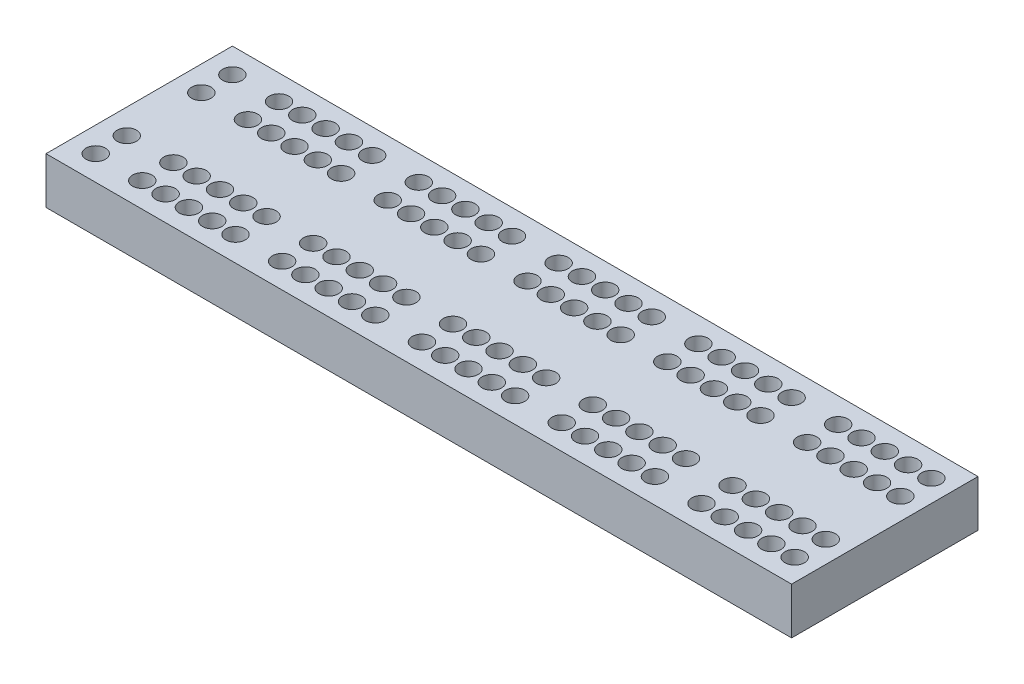
from build123d import *

# Parameters (mm, degrees)
SKETCH1_W            = 304.8
SKETCH1_H            = 19.05
BOSS_EXTRUDE1_DEPTH  = 38.1
LPATTERN1_COUNT      = 31
LPATTERN1_PITCH      = 9.525
LPATTERN1_COUNT_DIR2 = 2
LPATTERN1_PITCH_DIR2 = 12.7


with BuildPart() as part:
    # Sketch1 → Boss-Extrude1 (new, symmetric)
    with BuildSketch(Plane.XY):
        with Locations((152.4, -9.525)):
            Rectangle(SKETCH1_W, SKETCH1_H)
    extrude(amount=BOSS_EXTRUDE1_DEPTH, both=True)

    # Sketch4 → 5/16 (0.3125) Diameter Hole1 (revolve, cut)
    with BuildSketch(Plane(origin=(10.16, 0, -27.94), x_dir=(0, 0, 1), z_dir=(1, 0, 0))):
        Polygon((0, 0), (0, 15.084665582), (3.96875, 12.7), (3.96875, 0), align=None)
    f_5_16_0_3125_diameter_hole1 = revolve(axis=Axis((10.16, 6.35, -27.94), (0, -1, 0)), mode=Mode.SUBTRACT)

    # LPattern1: 5_16 _0.3125_ Diameter Hole1 31 × 2, 10 skipped
    with Locations(*[(i * LPATTERN1_PITCH, 0, j * LPATTERN1_PITCH_DIR2) for i in range(LPATTERN1_COUNT) for j in range(LPATTERN1_COUNT_DIR2) if (i, j) not in ((0, 0), (1, 0), (1, 1), (7, 0), (7, 1), (13, 0), (13, 1), (19, 0), (19, 1), (25, 0), (25, 1))]):
        add(f_5_16_0_3125_diameter_hole1, mode=Mode.SUBTRACT)

    # Mirror1: 5/16 (0.3125) Diameter Hole1 across plane
    add(f_5_16_0_3125_diameter_hole1.mirror(Plane.XY), mode=Mode.SUBTRACT)

    # Mirror1 copy 1 sketch → Mirror1 copy 1 (revolve, cut)
    with BuildSketch(Plane(origin=(10.16, 0, 15.24), x_dir=(0, 0, -1), z_dir=(1, 0, 0))):
        Polygon((0, 0), (0, -15.084665582), (3.96875, -12.7), (3.96875, 0), align=None)
    revolve(axis=Axis((10.16, 6.35, 15.24), (0, 1, 0)), mode=Mode.SUBTRACT)

    # Mirror1 copy 2 sketch → Mirror1 copy 2 (revolve, cut)
    with BuildSketch(Plane(origin=(29.21, 0, 27.94), x_dir=(0, 0, -1), z_dir=(1, 0, 0))):
        Polygon((0, 0), (0, -15.084665582), (3.96875, -12.7), (3.96875, 0), align=None)
    revolve(axis=Axis((29.21, 6.35, 27.94), (0, 1, 0)), mode=Mode.SUBTRACT)

    # Mirror1 copy 3 sketch → Mirror1 copy 3 (revolve, cut)
    with BuildSketch(Plane(origin=(29.21, 0, 15.24), x_dir=(0, 0, -1), z_dir=(1, 0, 0))):
        Polygon((0, 0), (0, -15.084665582), (3.96875, -12.7), (3.96875, 0), align=None)
    revolve(axis=Axis((29.21, 6.35, 15.24), (0, 1, 0)), mode=Mode.SUBTRACT)

    # Mirror1 copy 4 sketch → Mirror1 copy 4 (revolve, cut)
    with BuildSketch(Plane(origin=(38.735, 0, 27.94), x_dir=(0, 0, -1), z_dir=(1, 0, 0))):
        Polygon((0, 0), (0, -15.084665582), (3.96875, -12.7), (3.96875, 0), align=None)
    revolve(axis=Axis((38.735, 6.35, 27.94), (0, 1, 0)), mode=Mode.SUBTRACT)

    # Mirror1 copy 5 sketch → Mirror1 copy 5 (revolve, cut)
    with BuildSketch(Plane(origin=(38.735, 0, 15.24), x_dir=(0, 0, -1), z_dir=(1, 0, 0))):
        Polygon((0, 0), (0, -15.084665582), (3.96875, -12.7), (3.96875, 0), align=None)
    revolve(axis=Axis((38.735, 6.35, 15.24), (0, 1, 0)), mode=Mode.SUBTRACT)

    # Mirror1 copy 6 sketch → Mirror1 copy 6 (revolve, cut)
    with BuildSketch(Plane(origin=(48.26, 0, 27.94), x_dir=(0, 0, -1), z_dir=(1, 0, 0))):
        Polygon((0, 0), (0, -15.084665582), (3.96875, -12.7), (3.96875, 0), align=None)
    revolve(axis=Axis((48.26, 6.35, 27.94), (0, 1, 0)), mode=Mode.SUBTRACT)

    # Mirror1 copy 7 sketch → Mirror1 copy 7 (revolve, cut)
    with BuildSketch(Plane(origin=(48.26, 0, 15.24), x_dir=(0, 0, -1), z_dir=(1, 0, 0))):
        Polygon((0, 0), (0, -15.084665582), (3.96875, -12.7), (3.96875, 0), align=None)
    revolve(axis=Axis((48.26, 6.35, 15.24), (0, 1, 0)), mode=Mode.SUBTRACT)

    # Mirror1 copy 8 sketch → Mirror1 copy 8 (revolve, cut)
    with BuildSketch(Plane(origin=(57.785, 0, 27.94), x_dir=(0, 0, -1), z_dir=(1, 0, 0))):
        Polygon((0, 0), (0, -15.084665582), (3.96875, -12.7), (3.96875, 0), align=None)
    revolve(axis=Axis((57.785, 6.35, 27.94), (0, 1, 0)), mode=Mode.SUBTRACT)

    # Mirror1 copy 9 sketch → Mirror1 copy 9 (revolve, cut)
    with BuildSketch(Plane(origin=(57.785, 0, 15.24), x_dir=(0, 0, -1), z_dir=(1, 0, 0))):
        Polygon((0, 0), (0, -15.084665582), (3.96875, -12.7), (3.96875, 0), align=None)
    revolve(axis=Axis((57.785, 6.35, 15.24), (0, 1, 0)), mode=Mode.SUBTRACT)

    # Mirror1 copy 10 sketch → Mirror1 copy 10 (revolve, cut)
    with BuildSketch(Plane(origin=(67.31, 0, 27.94), x_dir=(0, 0, -1), z_dir=(1, 0, 0))):
        Polygon((0, 0), (0, -15.084665582), (3.96875, -12.7), (3.96875, 0), align=None)
    revolve(axis=Axis((67.31, 6.35, 27.94), (0, 1, 0)), mode=Mode.SUBTRACT)

    # Mirror1 copy 11 sketch → Mirror1 copy 11 (revolve, cut)
    with BuildSketch(Plane(origin=(67.31, 0, 15.24), x_dir=(0, 0, -1), z_dir=(1, 0, 0))):
        Polygon((0, 0), (0, -15.084665582), (3.96875, -12.7), (3.96875, 0), align=None)
    revolve(axis=Axis((67.31, 6.35, 15.24), (0, 1, 0)), mode=Mode.SUBTRACT)

    # Mirror1 copy 12 sketch → Mirror1 copy 12 (revolve, cut)
    with BuildSketch(Plane(origin=(86.36, 0, 27.94), x_dir=(0, 0, -1), z_dir=(1, 0, 0))):
        Polygon((0, 0), (0, -15.084665582), (3.96875, -12.7), (3.96875, 0), align=None)
    revolve(axis=Axis((86.36, 6.35, 27.94), (0, 1, 0)), mode=Mode.SUBTRACT)

    # Mirror1 copy 13 sketch → Mirror1 copy 13 (revolve, cut)
    with BuildSketch(Plane(origin=(86.36, 0, 15.24), x_dir=(0, 0, -1), z_dir=(1, 0, 0))):
        Polygon((0, 0), (0, -15.084665582), (3.96875, -12.7), (3.96875, 0), align=None)
    revolve(axis=Axis((86.36, 6.35, 15.24), (0, 1, 0)), mode=Mode.SUBTRACT)

    # Mirror1 copy 14 sketch → Mirror1 copy 14 (revolve, cut)
    with BuildSketch(Plane(origin=(95.885, 0, 27.94), x_dir=(0, 0, -1), z_dir=(1, 0, 0))):
        Polygon((0, 0), (0, -15.084665582), (3.96875, -12.7), (3.96875, 0), align=None)
    revolve(axis=Axis((95.885, 6.35, 27.94), (0, 1, 0)), mode=Mode.SUBTRACT)

    # Mirror1 copy 15 sketch → Mirror1 copy 15 (revolve, cut)
    with BuildSketch(Plane(origin=(95.885, 0, 15.24), x_dir=(0, 0, -1), z_dir=(1, 0, 0))):
        Polygon((0, 0), (0, -15.084665582), (3.96875, -12.7), (3.96875, 0), align=None)
    revolve(axis=Axis((95.885, 6.35, 15.24), (0, 1, 0)), mode=Mode.SUBTRACT)

    # Mirror1 copy 16 sketch → Mirror1 copy 16 (revolve, cut)
    with BuildSketch(Plane(origin=(105.41, 0, 27.94), x_dir=(0, 0, -1), z_dir=(1, 0, 0))):
        Polygon((0, 0), (0, -15.084665582), (3.96875, -12.7), (3.96875, 0), align=None)
    revolve(axis=Axis((105.41, 6.35, 27.94), (0, 1, 0)), mode=Mode.SUBTRACT)

    # Mirror1 copy 17 sketch → Mirror1 copy 17 (revolve, cut)
    with BuildSketch(Plane(origin=(105.41, 0, 15.24), x_dir=(0, 0, -1), z_dir=(1, 0, 0))):
        Polygon((0, 0), (0, -15.084665582), (3.96875, -12.7), (3.96875, 0), align=None)
    revolve(axis=Axis((105.41, 6.35, 15.24), (0, 1, 0)), mode=Mode.SUBTRACT)

    # Mirror1 copy 18 sketch → Mirror1 copy 18 (revolve, cut)
    with BuildSketch(Plane(origin=(114.935, 0, 27.94), x_dir=(0, 0, -1), z_dir=(1, 0, 0))):
        Polygon((0, 0), (0, -15.084665582), (3.96875, -12.7), (3.96875, 0), align=None)
    revolve(axis=Axis((114.935, 6.35, 27.94), (0, 1, 0)), mode=Mode.SUBTRACT)

    # Mirror1 copy 19 sketch → Mirror1 copy 19 (revolve, cut)
    with BuildSketch(Plane(origin=(114.935, 0, 15.24), x_dir=(0, 0, -1), z_dir=(1, 0, 0))):
        Polygon((0, 0), (0, -15.084665582), (3.96875, -12.7), (3.96875, 0), align=None)
    revolve(axis=Axis((114.935, 6.35, 15.24), (0, 1, 0)), mode=Mode.SUBTRACT)

    # Mirror1 copy 20 sketch → Mirror1 copy 20 (revolve, cut)
    with BuildSketch(Plane(origin=(124.46, 0, 27.94), x_dir=(0, 0, -1), z_dir=(1, 0, 0))):
        Polygon((0, 0), (0, -15.084665582), (3.96875, -12.7), (3.96875, 0), align=None)
    revolve(axis=Axis((124.46, 6.35, 27.94), (0, 1, 0)), mode=Mode.SUBTRACT)

    # Mirror1 copy 21 sketch → Mirror1 copy 21 (revolve, cut)
    with BuildSketch(Plane(origin=(124.46, 0, 15.24), x_dir=(0, 0, -1), z_dir=(1, 0, 0))):
        Polygon((0, 0), (0, -15.084665582), (3.96875, -12.7), (3.96875, 0), align=None)
    revolve(axis=Axis((124.46, 6.35, 15.24), (0, 1, 0)), mode=Mode.SUBTRACT)

    # Mirror1 copy 22 sketch → Mirror1 copy 22 (revolve, cut)
    with BuildSketch(Plane(origin=(143.51, 0, 27.94), x_dir=(0, 0, -1), z_dir=(1, 0, 0))):
        Polygon((0, 0), (0, -15.084665582), (3.96875, -12.7), (3.96875, 0), align=None)
    revolve(axis=Axis((143.51, 6.35, 27.94), (0, 1, 0)), mode=Mode.SUBTRACT)

    # Mirror1 copy 23 sketch → Mirror1 copy 23 (revolve, cut)
    with BuildSketch(Plane(origin=(143.51, 0, 15.24), x_dir=(0, 0, -1), z_dir=(1, 0, 0))):
        Polygon((0, 0), (0, -15.084665582), (3.96875, -12.7), (3.96875, 0), align=None)
    revolve(axis=Axis((143.51, 6.35, 15.24), (0, 1, 0)), mode=Mode.SUBTRACT)

    # Mirror1 copy 24 sketch → Mirror1 copy 24 (revolve, cut)
    with BuildSketch(Plane(origin=(153.035, 0, 27.94), x_dir=(0, 0, -1), z_dir=(1, 0, 0))):
        Polygon((0, 0), (0, -15.084665582), (3.96875, -12.7), (3.96875, 0), align=None)
    revolve(axis=Axis((153.035, 6.35, 27.94), (0, 1, 0)), mode=Mode.SUBTRACT)

    # Mirror1 copy 25 sketch → Mirror1 copy 25 (revolve, cut)
    with BuildSketch(Plane(origin=(153.035, 0, 15.24), x_dir=(0, 0, -1), z_dir=(1, 0, 0))):
        Polygon((0, 0), (0, -15.084665582), (3.96875, -12.7), (3.96875, 0), align=None)
    revolve(axis=Axis((153.035, 6.35, 15.24), (0, 1, 0)), mode=Mode.SUBTRACT)

    # Mirror1 copy 26 sketch → Mirror1 copy 26 (revolve, cut)
    with BuildSketch(Plane(origin=(162.56, 0, 27.94), x_dir=(0, 0, -1), z_dir=(1, 0, 0))):
        Polygon((0, 0), (0, -15.084665582), (3.96875, -12.7), (3.96875, 0), align=None)
    revolve(axis=Axis((162.56, 6.35, 27.94), (0, 1, 0)), mode=Mode.SUBTRACT)

    # Mirror1 copy 27 sketch → Mirror1 copy 27 (revolve, cut)
    with BuildSketch(Plane(origin=(162.56, 0, 15.24), x_dir=(0, 0, -1), z_dir=(1, 0, 0))):
        Polygon((0, 0), (0, -15.084665582), (3.96875, -12.7), (3.96875, 0), align=None)
    revolve(axis=Axis((162.56, 6.35, 15.24), (0, 1, 0)), mode=Mode.SUBTRACT)

    # Mirror1 copy 28 sketch → Mirror1 copy 28 (revolve, cut)
    with BuildSketch(Plane(origin=(172.085, 0, 27.94), x_dir=(0, 0, -1), z_dir=(1, 0, 0))):
        Polygon((0, 0), (0, -15.084665582), (3.96875, -12.7), (3.96875, 0), align=None)
    revolve(axis=Axis((172.085, 6.35, 27.94), (0, 1, 0)), mode=Mode.SUBTRACT)

    # Mirror1 copy 29 sketch → Mirror1 copy 29 (revolve, cut)
    with BuildSketch(Plane(origin=(172.085, 0, 15.24), x_dir=(0, 0, -1), z_dir=(1, 0, 0))):
        Polygon((0, 0), (0, -15.084665582), (3.96875, -12.7), (3.96875, 0), align=None)
    revolve(axis=Axis((172.085, 6.35, 15.24), (0, 1, 0)), mode=Mode.SUBTRACT)

    # Mirror1 copy 30 sketch → Mirror1 copy 30 (revolve, cut)
    with BuildSketch(Plane(origin=(181.61, 0, 27.94), x_dir=(0, 0, -1), z_dir=(1, 0, 0))):
        Polygon((0, 0), (0, -15.084665582), (3.96875, -12.7), (3.96875, 0), align=None)
    revolve(axis=Axis((181.61, 6.35, 27.94), (0, 1, 0)), mode=Mode.SUBTRACT)

    # Mirror1 copy 31 sketch → Mirror1 copy 31 (revolve, cut)
    with BuildSketch(Plane(origin=(181.61, 0, 15.24), x_dir=(0, 0, -1), z_dir=(1, 0, 0))):
        Polygon((0, 0), (0, -15.084665582), (3.96875, -12.7), (3.96875, 0), align=None)
    revolve(axis=Axis((181.61, 6.35, 15.24), (0, 1, 0)), mode=Mode.SUBTRACT)

    # Mirror1 copy 32 sketch → Mirror1 copy 32 (revolve, cut)
    with BuildSketch(Plane(origin=(200.66, 0, 27.94), x_dir=(0, 0, -1), z_dir=(1, 0, 0))):
        Polygon((0, 0), (0, -15.084665582), (3.96875, -12.7), (3.96875, 0), align=None)
    revolve(axis=Axis((200.66, 6.35, 27.94), (0, 1, 0)), mode=Mode.SUBTRACT)

    # Mirror1 copy 33 sketch → Mirror1 copy 33 (revolve, cut)
    with BuildSketch(Plane(origin=(200.66, 0, 15.24), x_dir=(0, 0, -1), z_dir=(1, 0, 0))):
        Polygon((0, 0), (0, -15.084665582), (3.96875, -12.7), (3.96875, 0), align=None)
    revolve(axis=Axis((200.66, 6.35, 15.24), (0, 1, 0)), mode=Mode.SUBTRACT)

    # Mirror1 copy 34 sketch → Mirror1 copy 34 (revolve, cut)
    with BuildSketch(Plane(origin=(210.185, 0, 27.94), x_dir=(0, 0, -1), z_dir=(1, 0, 0))):
        Polygon((0, 0), (0, -15.084665582), (3.96875, -12.7), (3.96875, 0), align=None)
    revolve(axis=Axis((210.185, 6.35, 27.94), (0, 1, 0)), mode=Mode.SUBTRACT)

    # Mirror1 copy 35 sketch → Mirror1 copy 35 (revolve, cut)
    with BuildSketch(Plane(origin=(210.185, 0, 15.24), x_dir=(0, 0, -1), z_dir=(1, 0, 0))):
        Polygon((0, 0), (0, -15.084665582), (3.96875, -12.7), (3.96875, 0), align=None)
    revolve(axis=Axis((210.185, 6.35, 15.24), (0, 1, 0)), mode=Mode.SUBTRACT)

    # Mirror1 copy 36 sketch → Mirror1 copy 36 (revolve, cut)
    with BuildSketch(Plane(origin=(219.71, 0, 27.94), x_dir=(0, 0, -1), z_dir=(1, 0, 0))):
        Polygon((0, 0), (0, -15.084665582), (3.96875, -12.7), (3.96875, 0), align=None)
    revolve(axis=Axis((219.71, 6.35, 27.94), (0, 1, 0)), mode=Mode.SUBTRACT)

    # Mirror1 copy 37 sketch → Mirror1 copy 37 (revolve, cut)
    with BuildSketch(Plane(origin=(219.71, 0, 15.24), x_dir=(0, 0, -1), z_dir=(1, 0, 0))):
        Polygon((0, 0), (0, -15.084665582), (3.96875, -12.7), (3.96875, 0), align=None)
    revolve(axis=Axis((219.71, 6.35, 15.24), (0, 1, 0)), mode=Mode.SUBTRACT)

    # Mirror1 copy 38 sketch → Mirror1 copy 38 (revolve, cut)
    with BuildSketch(Plane(origin=(229.235, 0, 27.94), x_dir=(0, 0, -1), z_dir=(1, 0, 0))):
        Polygon((0, 0), (0, -15.084665582), (3.96875, -12.7), (3.96875, 0), align=None)
    revolve(axis=Axis((229.235, 6.35, 27.94), (0, 1, 0)), mode=Mode.SUBTRACT)

    # Mirror1 copy 39 sketch → Mirror1 copy 39 (revolve, cut)
    with BuildSketch(Plane(origin=(229.235, 0, 15.24), x_dir=(0, 0, -1), z_dir=(1, 0, 0))):
        Polygon((0, 0), (0, -15.084665582), (3.96875, -12.7), (3.96875, 0), align=None)
    revolve(axis=Axis((229.235, 6.35, 15.24), (0, 1, 0)), mode=Mode.SUBTRACT)

    # Mirror1 copy 40 sketch → Mirror1 copy 40 (revolve, cut)
    with BuildSketch(Plane(origin=(238.76, 0, 27.94), x_dir=(0, 0, -1), z_dir=(1, 0, 0))):
        Polygon((0, 0), (0, -15.084665582), (3.96875, -12.7), (3.96875, 0), align=None)
    revolve(axis=Axis((238.76, 6.35, 27.94), (0, 1, 0)), mode=Mode.SUBTRACT)

    # Mirror1 copy 41 sketch → Mirror1 copy 41 (revolve, cut)
    with BuildSketch(Plane(origin=(238.76, 0, 15.24), x_dir=(0, 0, -1), z_dir=(1, 0, 0))):
        Polygon((0, 0), (0, -15.084665582), (3.96875, -12.7), (3.96875, 0), align=None)
    revolve(axis=Axis((238.76, 6.35, 15.24), (0, 1, 0)), mode=Mode.SUBTRACT)

    # Mirror1 copy 42 sketch → Mirror1 copy 42 (revolve, cut)
    with BuildSketch(Plane(origin=(257.81, 0, 27.94), x_dir=(0, 0, -1), z_dir=(1, 0, 0))):
        Polygon((0, 0), (0, -15.084665582), (3.96875, -12.7), (3.96875, 0), align=None)
    revolve(axis=Axis((257.81, 6.35, 27.94), (0, 1, 0)), mode=Mode.SUBTRACT)

    # Mirror1 copy 43 sketch → Mirror1 copy 43 (revolve, cut)
    with BuildSketch(Plane(origin=(257.81, 0, 15.24), x_dir=(0, 0, -1), z_dir=(1, 0, 0))):
        Polygon((0, 0), (0, -15.084665582), (3.96875, -12.7), (3.96875, 0), align=None)
    revolve(axis=Axis((257.81, 6.35, 15.24), (0, 1, 0)), mode=Mode.SUBTRACT)

    # Mirror1 copy 44 sketch → Mirror1 copy 44 (revolve, cut)
    with BuildSketch(Plane(origin=(267.335, 0, 27.94), x_dir=(0, 0, -1), z_dir=(1, 0, 0))):
        Polygon((0, 0), (0, -15.084665582), (3.96875, -12.7), (3.96875, 0), align=None)
    revolve(axis=Axis((267.335, 6.35, 27.94), (0, 1, 0)), mode=Mode.SUBTRACT)

    # Mirror1 copy 45 sketch → Mirror1 copy 45 (revolve, cut)
    with BuildSketch(Plane(origin=(267.335, 0, 15.24), x_dir=(0, 0, -1), z_dir=(1, 0, 0))):
        Polygon((0, 0), (0, -15.084665582), (3.96875, -12.7), (3.96875, 0), align=None)
    revolve(axis=Axis((267.335, 6.35, 15.24), (0, 1, 0)), mode=Mode.SUBTRACT)

    # Mirror1 copy 46 sketch → Mirror1 copy 46 (revolve, cut)
    with BuildSketch(Plane(origin=(276.86, 0, 27.94), x_dir=(0, 0, -1), z_dir=(1, 0, 0))):
        Polygon((0, 0), (0, -15.084665582), (3.96875, -12.7), (3.96875, 0), align=None)
    revolve(axis=Axis((276.86, 6.35, 27.94), (0, 1, 0)), mode=Mode.SUBTRACT)

    # Mirror1 copy 47 sketch → Mirror1 copy 47 (revolve, cut)
    with BuildSketch(Plane(origin=(276.86, 0, 15.24), x_dir=(0, 0, -1), z_dir=(1, 0, 0))):
        Polygon((0, 0), (0, -15.084665582), (3.96875, -12.7), (3.96875, 0), align=None)
    revolve(axis=Axis((276.86, 6.35, 15.24), (0, 1, 0)), mode=Mode.SUBTRACT)

    # Mirror1 copy 48 sketch → Mirror1 copy 48 (revolve, cut)
    with BuildSketch(Plane(origin=(286.385, 0, 27.94), x_dir=(0, 0, -1), z_dir=(1, 0, 0))):
        Polygon((0, 0), (0, -15.084665582), (3.96875, -12.7), (3.96875, 0), align=None)
    revolve(axis=Axis((286.385, 6.35, 27.94), (0, 1, 0)), mode=Mode.SUBTRACT)

    # Mirror1 copy 49 sketch → Mirror1 copy 49 (revolve, cut)
    with BuildSketch(Plane(origin=(286.385, 0, 15.24), x_dir=(0, 0, -1), z_dir=(1, 0, 0))):
        Polygon((0, 0), (0, -15.084665582), (3.96875, -12.7), (3.96875, 0), align=None)
    revolve(axis=Axis((286.385, 6.35, 15.24), (0, 1, 0)), mode=Mode.SUBTRACT)

    # Mirror1 copy 50 sketch → Mirror1 copy 50 (revolve, cut)
    with BuildSketch(Plane(origin=(295.91, 0, 27.94), x_dir=(0, 0, -1), z_dir=(1, 0, 0))):
        Polygon((0, 0), (0, -15.084665582), (3.96875, -12.7), (3.96875, 0), align=None)
    revolve(axis=Axis((295.91, 6.35, 27.94), (0, 1, 0)), mode=Mode.SUBTRACT)

    # Mirror1 copy 51 sketch → Mirror1 copy 51 (revolve, cut)
    with BuildSketch(Plane(origin=(295.91, 0, 15.24), x_dir=(0, 0, -1), z_dir=(1, 0, 0))):
        Polygon((0, 0), (0, -15.084665582), (3.96875, -12.7), (3.96875, 0), align=None)
    revolve(axis=Axis((295.91, 6.35, 15.24), (0, 1, 0)), mode=Mode.SUBTRACT)


solid = part.part
